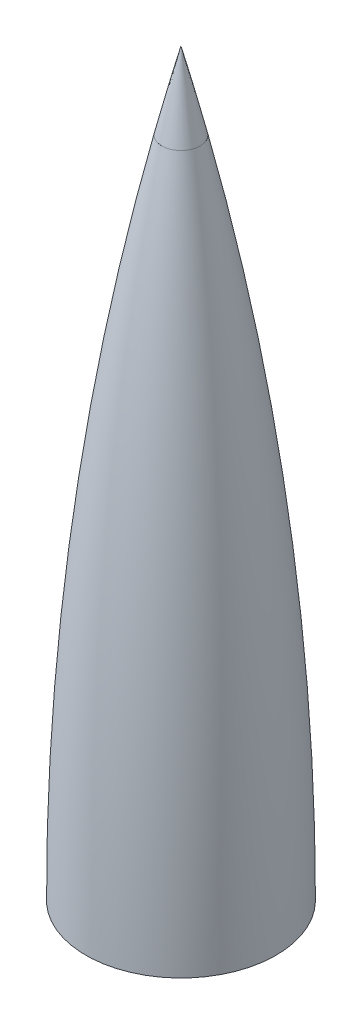
from build123d import *

# Parameters (mm, degrees)
SHELL1_T = -2.1844


with BuildPart() as part:
    # Sketch1 → Revolve1 (revolve)
    with BuildSketch(Plane.XY, mode=Mode.PRIVATE) as revolve1_sk:
        with BuildLine():
            Line((0, 546.1), (15.681796806, 546.1))
            ThreePointArc((15.681796806, 546.1), (62.638434539, 274.842519363), (78.359, 0))
            Line((78.359, 0), (0, 0))
            Line((0, 0), (0, 546.1))
        make_face()
    revolve(revolve1_sk.sketch.rotate(Axis((0, 0, 0), (0, 1, 0)), 90), axis=Axis((0, 0, 0), (0, 1, 0)))

    # Shell1
    shell1_openings = [part.faces().sort_by_distance(p)[0] for p in [
        (0, 546.1, 0),
        (0, 0, 0),
    ]]
    offset(amount=SHELL1_T, openings=shell1_openings, kind=Kind.INTERSECTION)


with BuildPart() as body_2:
    # Sketch2 → Revolve2 (revolve)
    with BuildSketch(Plane.XY, mode=Mode.PRIVATE) as revolve2_sk:
        with BuildLine():
            Line((0, 546.1), (0, 609.6))
            ThreePointArc((0, 609.6), (8.05629672, 577.903194215), (15.681796806, 546.1))
            Line((15.681796806, 546.1), (0, 546.1))
        make_face()
    revolve(revolve2_sk.sketch.rotate(Axis((0, 609.6, 0), (0, -1, 0)), 270), axis=Axis((0, 609.6, 0), (0, -1, 0)))


solid = Compound([part.part, body_2.part])
